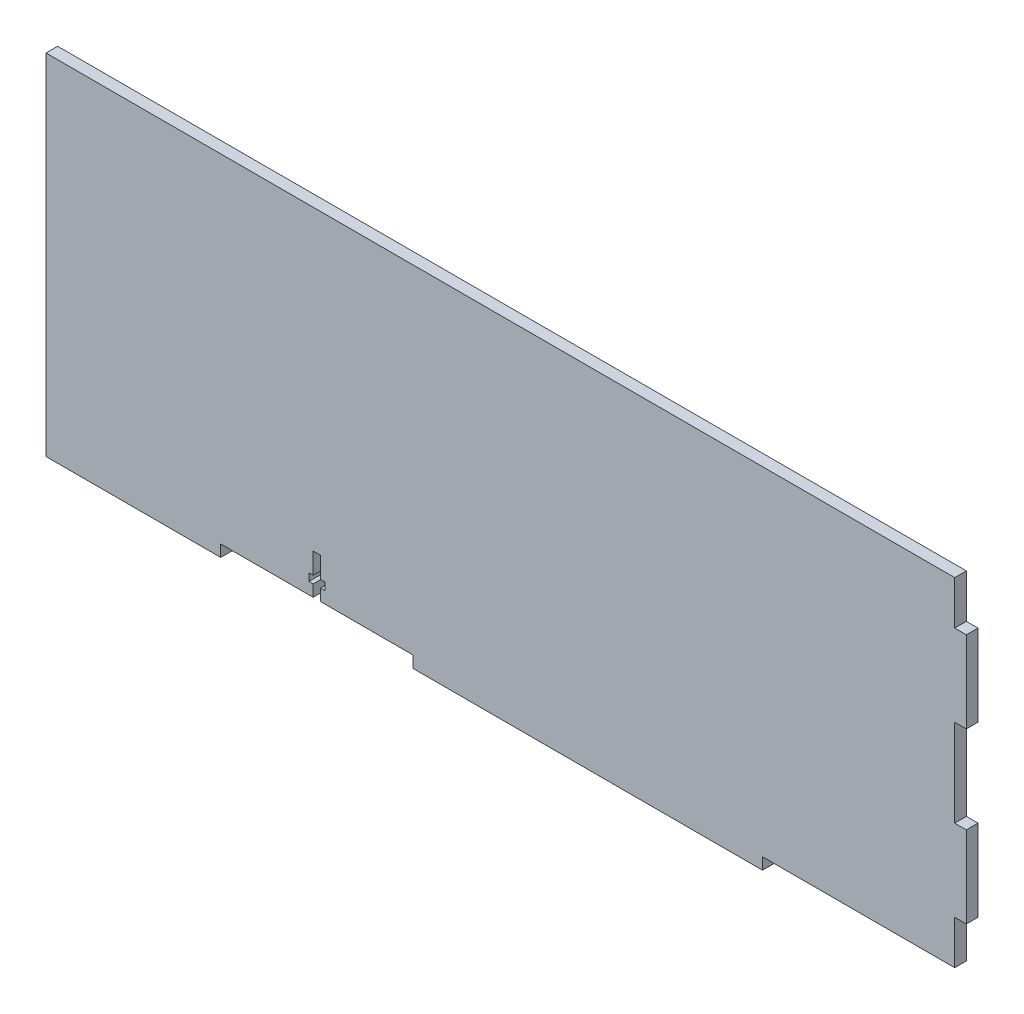
from build123d import *

# Parameters (mm, degrees)
CROQUIS1_W              = 780
CROQUIS1_H              = 145
CROQUIS1_W_2            = 150
CROQUIS1_H_2            = 5
CROQUIS1_W_3            = 5
CROQUIS1_H_3            = 35
SALIENTE_EXTRUIR1_DEPTH = 5
CORTAR_EXTRUIR1_DEPTH   = 10
CORTAR_EXTRUIR2_DEPTH   = 10


with BuildPart() as part:
    # Croquis1 → Saliente-Extruir1 (new body)
    with BuildSketch(Plane.XY):
        with Locations((390, 72.5)):
            Rectangle(CROQUIS1_W, CROQUIS1_H)
        with Locations((622.5, -2.5)):
            Rectangle(CROQUIS1_W_2, CROQUIS1_H_2)
        Polygon((390, 0), (315, 0), (315, -5), (465, -5), (465, 0), align=None)
        with Locations((157.5, -2.5)):
            Rectangle(CROQUIS1_W_2, CROQUIS1_H_2)
        with Locations((-2.5, 36.25)):
            Rectangle(CROQUIS1_W_3, CROQUIS1_H_3)
        with Locations((782.5, 36.25)):
            Rectangle(CROQUIS1_W_3, CROQUIS1_H_3)
        with Locations((782.5, 108.75)):
            Rectangle(CROQUIS1_W_3, CROQUIS1_H_3)
        with Locations((-2.5, 108.75)):
            Rectangle(CROQUIS1_W_3, CROQUIS1_H_3)
    extrude(amount=SALIENTE_EXTRUIR1_DEPTH)

    # Croquis2 → Cortar-Extruir1 (cut)
    with BuildSketch(Plane.XY.offset(5)):
        Polygon((275.35, 0), (272.15, 0), (272.15, 5), (270.35, 5), (270.35, 8.2), (272.15, 8.2), (272.15, 17.2), (275.35, 17.2), (275.35, 8.2), (277.15, 8.2), (277.15, 5), (275.35, 5), align=None)
        Polygon((507.85, 8.2), (507.85, 17.2), (504.65, 17.2), (504.65, 8.2), (502.85, 8.2), (502.85, 5), (504.65, 5), (504.65, 0), (507.85, 0), (507.85, 5), (509.65, 5), (509.65, 8.2), align=None)
    extrude(amount=-CORTAR_EXTRUIR1_DEPTH, mode=Mode.SUBTRACT)

    # Croquis3 → Cortar-Extruir2 (cut)
    with BuildSketch(Plane.XY.offset(5)):
        Polygon((390, -5), (390, 196.910235404), (-39.994271309, 207.613084807), (-47.647656294, -99.866874564), (0, -99.866874564), align=None)
    extrude(amount=-CORTAR_EXTRUIR2_DEPTH, mode=Mode.SUBTRACT)


solid = part.part
